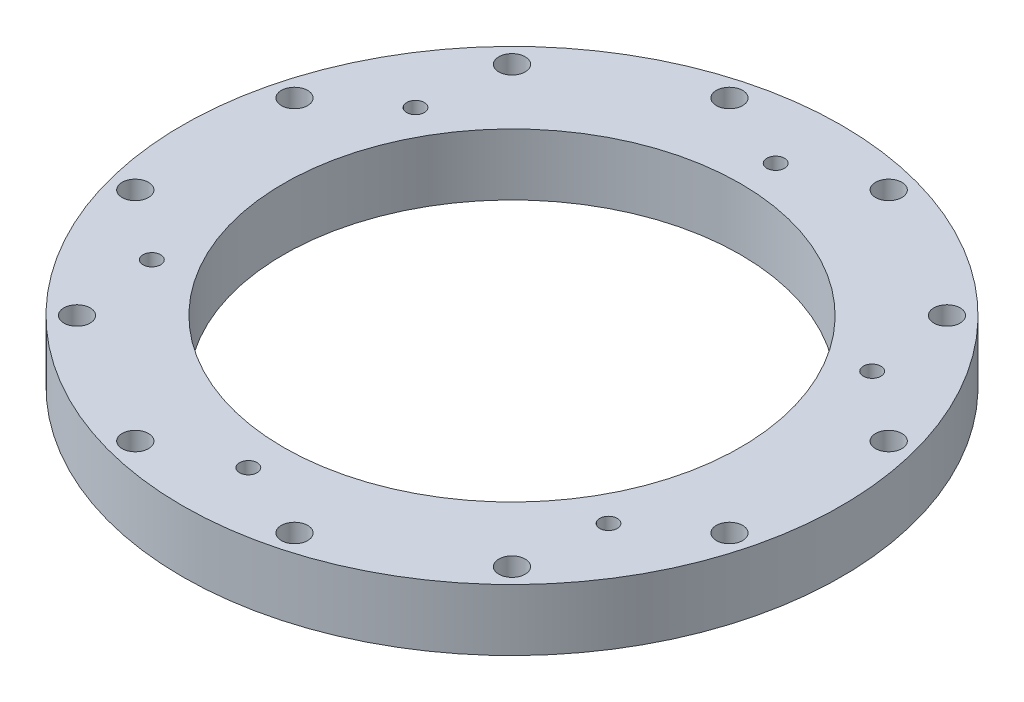
from build123d import *

# Parameters (mm, degrees)
SKETCH1_R           = 37.5
SKETCH1_R_2         = 26
SKETCH1_R_3         = 1
SKETCH1_R_4         = 1.5
BOSS_EXTRUDE1_DEPTH = 7


with BuildPart() as part:
    # Sketch1 → Boss-Extrude1 (new body)
    with BuildSketch(Plane(origin=(0, 0, 0), x_dir=(1, 0, 0), z_dir=(0, 1, 0))):
        with Locations(Location((0, 0, 0), (0, 0, 270))):
            Circle(SKETCH1_R)
        with Locations(Location((0, 0, 0), (0, 0, 270))):
            Circle(SKETCH1_R_2, mode=Mode.SUBTRACT)
        with Locations(Location((0, 30, 0), (0, 0, 270))):
            Circle(SKETCH1_R_3, mode=Mode.SUBTRACT)
        with Locations(Location((25.980762114, 15, 0), (0, 0, 270))):
            Circle(SKETCH1_R_3, mode=Mode.SUBTRACT)
        with Locations(Location((25.980762114, -15, 0), (0, 0, 270))):
            Circle(SKETCH1_R_3, mode=Mode.SUBTRACT)
        with Locations(Location((0, -30, 0), (0, 0, 270))):
            Circle(SKETCH1_R_3, mode=Mode.SUBTRACT)
        with Locations(Location((-25.980762114, -15, 0), (0, 0, 270))):
            Circle(SKETCH1_R_3, mode=Mode.SUBTRACT)
        with Locations(Location((-25.980762114, 15, 0), (0, 0, 270))):
            Circle(SKETCH1_R_3, mode=Mode.SUBTRACT)
        with Locations(Location((-33.80740392, -9.058666579, 0), (0, 0, 270))):
            Circle(SKETCH1_R_4, mode=Mode.SUBTRACT)
        with Locations(Location((-33.80740392, 9.058666579, 0), (0, 0, 270))):
            Circle(SKETCH1_R_4, mode=Mode.SUBTRACT)
        with Locations(Location((-24.748737342, 24.748737342, 0), (0, 0, 270))):
            Circle(SKETCH1_R_4, mode=Mode.SUBTRACT)
        with Locations(Location((-9.058666579, 33.80740392, 0), (0, 0, 270))):
            Circle(SKETCH1_R_4, mode=Mode.SUBTRACT)
        with Locations(Location((9.058666579, 33.80740392, 0), (0, 0, 270))):
            Circle(SKETCH1_R_4, mode=Mode.SUBTRACT)
        with Locations(Location((24.748737342, 24.748737342, 0), (0, 0, 270))):
            Circle(SKETCH1_R_4, mode=Mode.SUBTRACT)
        with Locations(Location((33.80740392, 9.058666579, 0), (0, 0, 270))):
            Circle(SKETCH1_R_4, mode=Mode.SUBTRACT)
        with Locations(Location((33.80740392, -9.058666579, 0), (0, 0, 270))):
            Circle(SKETCH1_R_4, mode=Mode.SUBTRACT)
        with Locations(Location((24.748737342, -24.748737342, 0), (0, 0, 270))):
            Circle(SKETCH1_R_4, mode=Mode.SUBTRACT)
        with Locations(Location((9.058666579, -33.80740392, 0), (0, 0, 270))):
            Circle(SKETCH1_R_4, mode=Mode.SUBTRACT)
        with Locations(Location((-9.058666579, -33.80740392, 0), (0, 0, 270))):
            Circle(SKETCH1_R_4, mode=Mode.SUBTRACT)
        with Locations(Location((-24.748737342, -24.748737342, 0), (0, 0, 270))):
            Circle(SKETCH1_R_4, mode=Mode.SUBTRACT)
    extrude(amount=BOSS_EXTRUDE1_DEPTH)


solid = part.part
